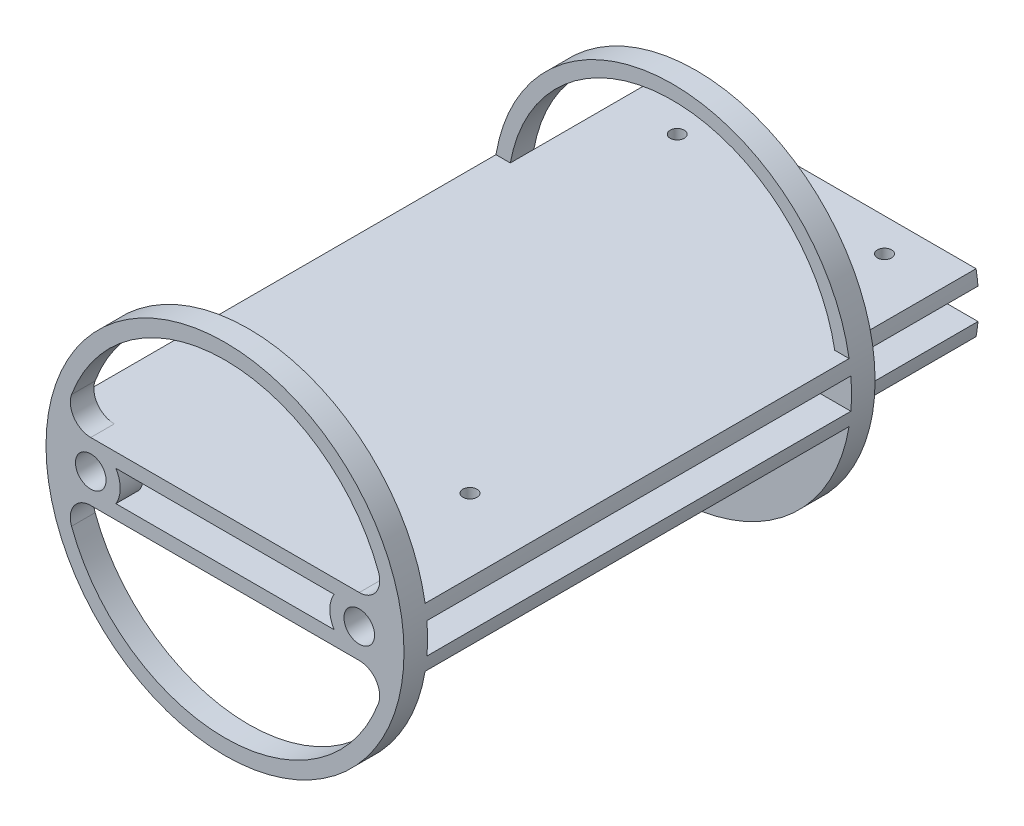
from build123d import *
from build123d.topology import SkipClean

# Parameters (mm, degrees)
SKETCH1_R           = 38
SKETCH1_R_2         = 3.25
BOSS_EXTRUDE1_DEPTH = 5
BOSS_EXTRUDE2_START = 90
BOSS_EXTRUDE2_DEPTH = 90
BOSS_EXTRUDE3_START = 5
BOSS_EXTRUDE3_DEPTH = 5
CUT_EXTRUDE1_REACH  = 113.477
SKETCH4_R           = 1.5
BOSS_EXTRUDE5_START = -95
BOSS_EXTRUDE5_DEPTH = 120
CUT_EXTRUDE2_REACH  = 135.424
SKETCH7_R           = 1.5
CUT_EXTRUDE3_REACH  = 115.525
BOSS_EXTRUDE6_DEPTH = 25


with BuildPart() as part:
    # Sketch1 → Boss-Extrude1 (new body)
    with BuildSketch(Plane.XY):
        Circle(SKETCH1_R)
        with Locations((-28.5, 0)):
            Circle(SKETCH1_R_2, mode=Mode.SUBTRACT)
        with Locations((28.5, 0)):
            Circle(SKETCH1_R_2, mode=Mode.SUBTRACT)
        with BuildLine():
            Line((-28.5, -6.25), (28.5, -6.25))
            ThreePointArc((28.5, -6.25), (32.067319136, -8.114790357), (32.572245062, -12.108317457))
            ThreePointArc((32.572245062, -12.108317457), (0, -34.75), (-32.572245062, -12.108317457))
            ThreePointArc((-32.572245062, -12.108317457), (-32.067319136, -8.114790357), (-28.5, -6.25))
        make_face(mode=Mode.SUBTRACT)
        with BuildLine():
            Line((-28.5, 6.25), (28.5, 6.25))
            ThreePointArc((28.5, 6.25), (32.067319136, 8.114790357), (32.572245062, 12.108317457))
            ThreePointArc((32.572245062, 12.108317457), (0, 34.75), (-32.572245062, 12.108317457))
            ThreePointArc((-32.572245062, 12.108317457), (-32.067319136, 8.114790357), (-28.5, 6.25))
        make_face(mode=Mode.SUBTRACT)
        with BuildLine():
            Line((23.161460874, 3.25), (-23.161460874, 3.25))
            ThreePointArc((-23.161460874, 3.25), (-22.25, 0), (-23.161460874, -3.25))
            Line((-23.161460874, -3.25), (23.161460874, -3.25))
            ThreePointArc((23.161460874, -3.25), (22.25, 0), (23.161460874, 3.25))
        make_face(mode=Mode.SUBTRACT)
    extrude(amount=BOSS_EXTRUDE1_DEPTH)

    # Sketch2 → Boss-Extrude2 (add)
    with BuildSketch(Plane(origin=(0, 0, 0), x_dir=(-1, 0, 0), z_dir=(0, 0, -1)).offset(BOSS_EXTRUDE2_START)):
        with BuildLine():
            Line((-37.860764652, -3.25), (37.860764652, -3.25))
            ThreePointArc((37.860764652, -3.25), (37.701481777, -4.753763962), (37.482495915, -6.25))
            Line((37.482495915, -6.25), (-37.482495915, -6.25))
            ThreePointArc((-37.482495915, -6.25), (-37.701481777, -4.753763962), (-37.860764652, -3.25))
        make_face()
        with BuildLine():
            Line((-37.482495915, 6.25), (37.482495915, 6.25))
            ThreePointArc((37.482495915, 6.25), (37.701481777, 4.753763962), (37.860764652, 3.25))
            Line((37.860764652, 3.25), (-37.860764652, 3.25))
            ThreePointArc((-37.860764652, 3.25), (-37.701481777, 4.753763962), (-37.482495915, 6.25))
        make_face()
    extrude(amount=-BOSS_EXTRUDE2_DEPTH)

    # Sketch3 → Boss-Extrude3 (add)
    with SkipClean():  # the faces are left unmerged after this step: merging them gives an invalid solid
        with BuildSketch(Plane(origin=(0, 0, -90), x_dir=(-1, 0, 0), z_dir=(0, 0, -1)).offset(BOSS_EXTRUDE3_START)):
            with BuildLine():
                ThreePointArc((37.860764652, 3.25), (37.701481777, 4.753763962), (37.482495915, 6.25))
                ThreePointArc((37.482495915, 6.25), (0, 38), (-37.482495915, 6.25))
                ThreePointArc((-37.482495915, 6.25), (-37.701481777, 4.753763962), (-37.860764652, 3.25))
                ThreePointArc((-37.860764652, 3.25), (-38, 0), (-37.860764652, -3.25))
                ThreePointArc((-37.860764652, -3.25), (-37.701481777, -4.753763962), (-37.482495915, -6.25))
                ThreePointArc((-37.482495915, -6.25), (0, -38), (37.482495915, -6.25))
                ThreePointArc((37.482495915, -6.25), (37.701481777, -4.753763962), (37.860764652, -3.25))
                ThreePointArc((37.860764652, -3.25), (38, 0), (37.860764652, 3.25))
            make_face()
            with BuildLine():
                ThreePointArc((-28.5, 3.25), (-31.75, 0), (-28.5, -3.25))
                ThreePointArc((-28.5, -3.25), (-25.25, 0), (-28.5, 3.25))
            make_face(mode=Mode.SUBTRACT)
            with BuildLine():
                ThreePointArc((28.5, 3.25), (25.25, 0), (28.5, -3.25))
                ThreePointArc((28.5, -3.25), (31.75, 0), (28.5, 3.25))
            make_face(mode=Mode.SUBTRACT)
        extrude(amount=-BOSS_EXTRUDE3_DEPTH)

    # Sketch4 → Cut-Extrude1 (cut, up to next)
    with BuildSketch(Plane(origin=(0, -6.25, 0), x_dir=(1, 0, 0), z_dir=(0, 1, 0)), mode=Mode.PRIVATE) as cut_extrude1_sk1:
        with Locations(Location((-24.5, 62, 0), (0, 0, 180))):
            Circle(SKETCH4_R)
    cut_extrude1_tool1 = extrude(cut_extrude1_sk1.sketch, amount=CUT_EXTRUDE1_REACH, mode=Mode.PRIVATE) & part.part
    # Sketch4 → Cut-Extrude1 (cut, up to next)
    with BuildSketch(Plane(origin=(0, -6.25, 0), x_dir=(1, 0, 0), z_dir=(0, 1, 0)), mode=Mode.PRIVATE) as cut_extrude1_sk2:
        with Locations(Location((24.5, 62, 0), (0, 0, 180))):
            Circle(SKETCH4_R)
    cut_extrude1_tool2 = extrude(cut_extrude1_sk2.sketch, amount=CUT_EXTRUDE1_REACH, mode=Mode.PRIVATE) & part.part
    # Sketch4 → Cut-Extrude1 (cut, up to next)
    with BuildSketch(Plane(origin=(0, -6.25, 0), x_dir=(1, 0, 0), z_dir=(0, 1, 0)), mode=Mode.PRIVATE) as cut_extrude1_sk3:
        with Locations(Location((24.5, 4, 0), (0, 0, 180))):
            Circle(SKETCH4_R)
    cut_extrude1_tool3 = extrude(cut_extrude1_sk3.sketch, amount=CUT_EXTRUDE1_REACH, mode=Mode.PRIVATE) & part.part
    # Sketch4 → Cut-Extrude1 (cut, up to next)
    with BuildSketch(Plane(origin=(0, -6.25, 0), x_dir=(1, 0, 0), z_dir=(0, 1, 0)), mode=Mode.PRIVATE) as cut_extrude1_sk4:
        with Locations(Location((-24.5, 4, 0), (0, 0, 180))):
            Circle(SKETCH4_R)
    cut_extrude1_tool4 = extrude(cut_extrude1_sk4.sketch, amount=CUT_EXTRUDE1_REACH, mode=Mode.PRIVATE) & part.part
    add(cut_extrude1_tool1.solids().sort_by_distance((-24.5, -6.25, -62))[0], mode=Mode.SUBTRACT)
    add(cut_extrude1_tool2.solids().sort_by_distance((24.5, -6.25, -62))[0], mode=Mode.SUBTRACT)
    add(cut_extrude1_tool3.solids().sort_by_distance((24.5, -6.25, -4))[0], mode=Mode.SUBTRACT)
    add(cut_extrude1_tool4.solids().sort_by_distance((-24.5, -6.25, -4))[0], mode=Mode.SUBTRACT)

    # Sketch6 → Boss-Extrude5 (add)
    with SkipClean():  # the faces are left unmerged after this step: merging them gives an invalid solid
        with BuildSketch(Plane(origin=(0, 0, -95), x_dir=(-1, 0, 0), z_dir=(0, 0, -1)).offset(BOSS_EXTRUDE5_START)):
            with BuildLine():
                Line((-34.437443285, 6.25), (34.437443285, 6.25))
                ThreePointArc((34.437443285, 6.25), (34.675570658, 4.754450501), (34.848780466, 3.25))
                Line((34.848780466, 3.25), (-34.848780466, 3.25))
                ThreePointArc((-34.848780466, 3.25), (-34.675570658, 4.754450501), (-34.437443285, 6.25))
            make_face()
        extrude(amount=BOSS_EXTRUDE5_DEPTH)

    # Sketch7 → Cut-Extrude2 (cut, up to next)
    with BuildSketch(Plane(origin=(0, 6.25, 0), x_dir=(1, 0, 0), z_dir=(0, 1, 0)), mode=Mode.PRIVATE) as cut_extrude2_sk1:
        with Locations(Location((-22, 113, 0), (0, 0, 180))):
            Circle(SKETCH7_R)
    cut_extrude2_tool1 = extrude(cut_extrude2_sk1.sketch, amount=-CUT_EXTRUDE2_REACH, mode=Mode.PRIVATE) & part.part
    # Sketch7 → Cut-Extrude2 (cut, up to next)
    with BuildSketch(Plane(origin=(0, 6.25, 0), x_dir=(1, 0, 0), z_dir=(0, 1, 0)), mode=Mode.PRIVATE) as cut_extrude2_sk2:
        with Locations(Location((22, 113, 0), (0, 0, 180))):
            Circle(SKETCH7_R)
    cut_extrude2_tool2 = extrude(cut_extrude2_sk2.sketch, amount=-CUT_EXTRUDE2_REACH, mode=Mode.PRIVATE) & part.part
    # Sketch7 → Cut-Extrude2 (cut, up to next)
    with BuildSketch(Plane(origin=(0, 6.25, 0), x_dir=(1, 0, 0), z_dir=(0, 1, 0)), mode=Mode.PRIVATE) as cut_extrude2_sk3:
        with Locations(Location((22, 25, 0), (0, 0, 180))):
            Circle(SKETCH7_R)
    cut_extrude2_tool3 = extrude(cut_extrude2_sk3.sketch, amount=-CUT_EXTRUDE2_REACH, mode=Mode.PRIVATE) & part.part
    # Sketch7 → Cut-Extrude2 (cut, up to next)
    with BuildSketch(Plane(origin=(0, 6.25, 0), x_dir=(1, 0, 0), z_dir=(0, 1, 0)), mode=Mode.PRIVATE) as cut_extrude2_sk4:
        with Locations(Location((-22, 25, 0), (0, 0, 180))):
            Circle(SKETCH7_R)
    cut_extrude2_tool4 = extrude(cut_extrude2_sk4.sketch, amount=-CUT_EXTRUDE2_REACH, mode=Mode.PRIVATE) & part.part
    add(cut_extrude2_tool1.solids().sort_by_distance((-22, 6.25, -113))[0], mode=Mode.SUBTRACT)
    add(cut_extrude2_tool2.solids().sort_by_distance((22, 6.25, -113))[0], mode=Mode.SUBTRACT)
    add(cut_extrude2_tool3.solids().sort_by_distance((22, 6.25, -25))[0], mode=Mode.SUBTRACT)
    add(cut_extrude2_tool4.solids().sort_by_distance((-22, 6.25, -25))[0], mode=Mode.SUBTRACT)

    # Sketch8 → Cut-Extrude3 (cut, up to next)
    with BuildSketch(Plane(origin=(0, 0, -95), x_dir=(-1, 0, 0), z_dir=(0, 0, -1)), mode=Mode.PRIVATE) as cut_extrude3_sk1:
        with BuildLine():
            Line((-34.437443285, 6.25), (34.437443285, 6.25))
            ThreePointArc((34.437443285, 6.25), (0, 35), (-34.437443285, 6.25))
        make_face()
    cut_extrude3_tool1 = extrude(cut_extrude3_sk1.sketch, amount=-CUT_EXTRUDE3_REACH, mode=Mode.PRIVATE) & part.part
    add(cut_extrude3_tool1.solids().sort_by_distance((0, 18.284736, -95))[0], mode=Mode.SUBTRACT)

    # Sketch9 → Boss-Extrude6 (add)
    with SkipClean():  # the faces are left unmerged after this step: merging them gives an invalid solid
        with BuildSketch(Plane(origin=(0, 0, -95), x_dir=(-1, 0, 0), z_dir=(0, 0, -1))):
            with BuildLine():
                Line((-34.848780466, -3.25), (34.848780466, -3.25))
                ThreePointArc((34.848780466, -3.25), (34.675570658, -4.754450501), (34.437443285, -6.25))
                Line((34.437443285, -6.25), (-34.437443285, -6.25))
                ThreePointArc((-34.437443285, -6.25), (-34.675570658, -4.754450501), (-34.848780466, -3.25))
            make_face()
        extrude(amount=BOSS_EXTRUDE6_DEPTH)


solid = part.part
